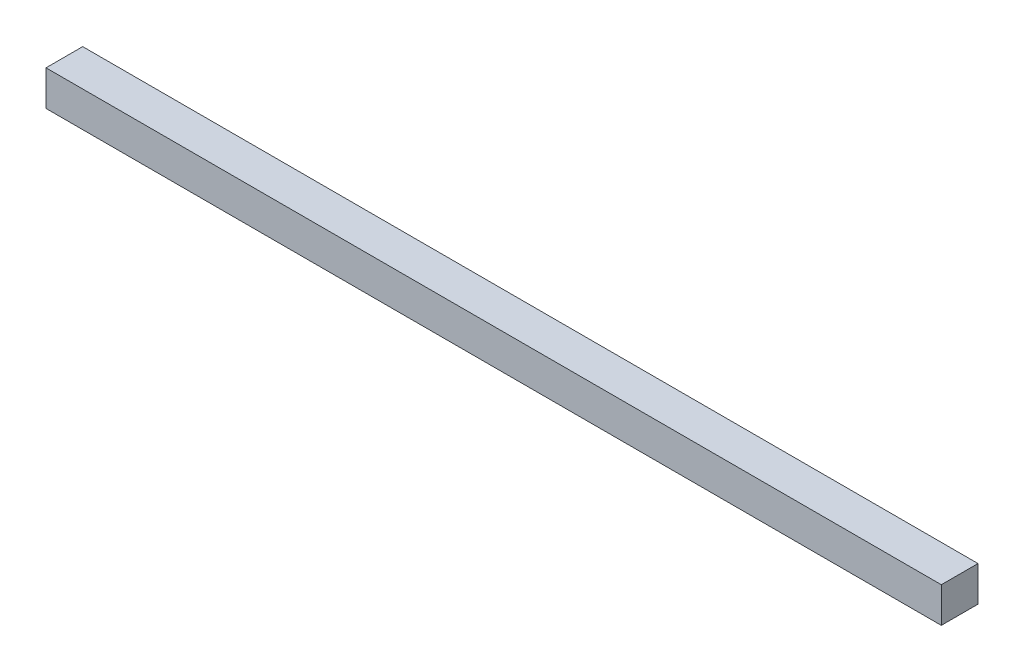
from build123d import *

# Parameters (mm, degrees)
SKETCH1_W            = 330
SKETCH1_H            = 275
SKETCH1_W_2          = 305
SKETCH1_H_2          = 250
BOSS_EXTRUDE4_DEPTH  = 12
BOSS_EXTRUDE6_DEPTH  = 12.5
BOSS_EXTRUDE7_DEPTH  = 12.5
SKETCH6_R            = 15
SKETCH6_R_2          = 11
BOSS_EXTRUDE8_DEPTH  = 12.5
SKETCH7_R            = 11
CUT_EXTRUDE2_DEPTH   = 383.003996993
BOSS_EXTRUDE9_REACH  = 283.371
SKETCH8_W            = 12.5
SKETCH8_H            = 10
BOSS_EXTRUDE10_REACH = 283.371
SKETCH9_W            = 12.5
SKETCH9_H            = 10
SKETCH10_W           = 25
SKETCH10_H           = 25
BOSS_EXTRUDE11_DEPTH = 12.5
SKETCH12_W           = 363.183166413
SKETCH12_H           = 208.972436991
CUT_EXTRUDE4_DEPTH   = 12.5
SKETCH13_W           = 88.849719952
SKETCH13_H           = 202.412650545
CUT_EXTRUDE5_DEPTH   = 12.5
SKETCH14_W           = 344.745227795
SKETCH14_H           = 211.856588458
CUT_EXTRUDE6_DEPTH   = 12.5
SKETCH15_W           = 201.860066461
SKETCH15_H           = 74.495762376
CUT_EXTRUDE7_DEPTH   = 390.5


with BuildPart() as part:
    # Sketch1 → Boss-Extrude4 (new body)
    with BuildSketch(Plane(origin=(0, 0, 0), x_dir=(1, 0, 0), z_dir=(0, 1, 0))):
        Rectangle(SKETCH1_W, SKETCH1_H)
        Rectangle(SKETCH1_W_2, SKETCH1_H_2, mode=Mode.SUBTRACT)
    extrude(amount=BOSS_EXTRUDE4_DEPTH)

    # Sketch2 → Boss-Extrude6 (add)
    with BuildSketch(Plane(origin=(165, 0, 0), x_dir=(0, 0, -1), z_dir=(1, 0, 0))):
        Polygon((0, 152), (-137.5, 12), (-127.5, 12), (0, 141.818181818), (127.5, 12), (137.5, 12), align=None)
    extrude(amount=-BOSS_EXTRUDE6_DEPTH)

    # Sketch5 → Boss-Extrude7 (add)
    with BuildSketch(Plane.ZY.offset(165)):
        Polygon((0, 152), (-137.5, 12), (-127.5, 12), (0, 141.818181818), (127.5, 12), (137.5, 12), align=None)
    extrude(amount=-BOSS_EXTRUDE7_DEPTH)

    # Sketch6 → Boss-Extrude8 (add)
    with BuildSketch(Plane.ZY.offset(-152.5)):
        with Locations((0, 146.909090909)):
            Circle(SKETCH6_R)
        with Locations((0, 146.909090909)):
            Circle(SKETCH6_R_2, mode=Mode.SUBTRACT)
    extrude(amount=-BOSS_EXTRUDE8_DEPTH)

    # Sketch7 → Cut-Extrude2 (cut, through all)
    with BuildSketch(Plane.ZY.offset(-152.5)):
        with Locations((0, 146.909090909)):
            Circle(SKETCH7_R)
    extrude(amount=-CUT_EXTRUDE2_DEPTH, mode=Mode.SUBTRACT)

    # Boss-Extrude9: up to this plane
    boss_extrude9_end = Plane(origin=(0, 12, 0), z_dir=(0, -1, 0))
    # Sketch8 → Boss-Extrude9 (add, up to the surface)
    with BuildSketch(Plane(origin=(0, 69.631553319, 70.897581561), x_dir=(-1, 0, 0), z_dir=(0, -0.7007080148842544, -0.7134481606094221)), mode=Mode.PRIVATE) as boss_extrude9_sk1:
        with Locations((-158.75, 10.200513494)):
            Rectangle(SKETCH8_W, SKETCH8_H)
    boss_extrude9_tool1 = split(extrude(boss_extrude9_sk1.sketch, amount=BOSS_EXTRUDE9_REACH, mode=Mode.PRIVATE), bisect_by=boss_extrude9_end, keep=Keep.BOTH, mode=Mode.PRIVATE)
    add(boss_extrude9_tool1.solids().sort_by_distance((158.75, 76.909091, 63.75))[0])
    # Sketch8 → Boss-Extrude9 (add, up to the surface)
    with BuildSketch(Plane(origin=(0, 69.631553319, 70.897581561), x_dir=(-1, 0, 0), z_dir=(0, -0.7007080148842544, -0.7134481606094221)), mode=Mode.PRIVATE) as boss_extrude9_sk2:
        with Locations((158.75, 10.200513494)):
            Rectangle(SKETCH8_W, SKETCH8_H)
    boss_extrude9_tool2 = split(extrude(boss_extrude9_sk2.sketch, amount=BOSS_EXTRUDE9_REACH, mode=Mode.PRIVATE), bisect_by=boss_extrude9_end, keep=Keep.BOTH, mode=Mode.PRIVATE)
    add(boss_extrude9_tool2.solids().sort_by_distance((-158.75, 76.909091, 63.75))[0])

    # Boss-Extrude10: up to this plane
    boss_extrude10_end = Plane(origin=(0, 12, 0), z_dir=(0, -1, 0))
    # Sketch9 → Boss-Extrude10 (add, up to the surface)
    with BuildSketch(Plane(origin=(0, 69.631553319, -70.897581561), x_dir=(1, 0, 0), z_dir=(0, -0.7007080148842544, 0.7134481606094221)), mode=Mode.PRIVATE) as boss_extrude10_sk1:
        with Locations((-158.75, 10.200513494)):
            Rectangle(SKETCH9_W, SKETCH9_H)
    boss_extrude10_tool1 = split(extrude(boss_extrude10_sk1.sketch, amount=BOSS_EXTRUDE10_REACH, mode=Mode.PRIVATE), bisect_by=boss_extrude10_end, keep=Keep.BOTH, mode=Mode.PRIVATE)
    add(boss_extrude10_tool1.solids().sort_by_distance((-158.75, 76.909091, -63.75))[0])
    # Sketch9 → Boss-Extrude10 (add, up to the surface)
    with BuildSketch(Plane(origin=(0, 69.631553319, -70.897581561), x_dir=(1, 0, 0), z_dir=(0, -0.7007080148842544, 0.7134481606094221)), mode=Mode.PRIVATE) as boss_extrude10_sk2:
        with Locations((158.75, 10.200513494)):
            Rectangle(SKETCH9_W, SKETCH9_H)
    boss_extrude10_tool2 = split(extrude(boss_extrude10_sk2.sketch, amount=BOSS_EXTRUDE10_REACH, mode=Mode.PRIVATE), bisect_by=boss_extrude10_end, keep=Keep.BOTH, mode=Mode.PRIVATE)
    add(boss_extrude10_tool2.solids().sort_by_distance((158.75, 76.909091, -63.75))[0])

    # Sketch10 → Boss-Extrude11 (add)
    with BuildSketch(Plane(origin=(-152.5, 0, 0), x_dir=(0, 0, -1), z_dir=(1, 0, 0))):
        with Locations((0, 146.909090909)):
            Rectangle(SKETCH10_W, SKETCH10_H)
    extrude(amount=-BOSS_EXTRUDE11_DEPTH)

    # Sketch11 → Revolve1 (revolve)
    with BuildSketch(Plane.XY, mode=Mode.PRIVATE) as revolve1_sk:
        with BuildLine():
            Line((152.5, 157.909090909), (152.5, 161.909090909))
            ThreePointArc((152.5, 161.909090909), (149.508436085, 160.260408588), (146.516872171, 161.909090909))
            Line((146.516872171, 161.909090909), (146.516872171, 157.909090909))
            Line((146.516872171, 157.909090909), (152.5, 157.909090909))
        make_face()
    revolve(revolve1_sk.sketch.rotate(Axis((152.5, 146.909090909, 0), (-1, 0, 0)), 270), axis=Axis((152.5, 146.909090909, 0), (-1, 0, 0)))

    # Sketch12 → Cut-Extrude4 (cut)
    with BuildSketch(Plane(origin=(165, 0, 0), x_dir=(0, 0, -1), z_dir=(1, 0, 0))):
        with Locations((44.091583207, 104.486218496)):
            Rectangle(SKETCH12_W, SKETCH12_H)
    extrude(amount=-CUT_EXTRUDE4_DEPTH, mode=Mode.SUBTRACT)


with BuildPart() as cut_extrude4_piece_1:
    # of the separate pieces the step leaves, piece 1, a body of its own (cut_extrude4_pieces)
    add(part.part.solids().sort_by_distance((-165, 0, 137.5))[0])

    # Sketch14 → Cut-Extrude6 (cut)
    with BuildSketch(Plane.ZY.offset(165)):
        with Locations((34.872613898, 105.928294229)):
            Rectangle(SKETCH14_W, SKETCH14_H)
    extrude(amount=-CUT_EXTRUDE6_DEPTH, mode=Mode.SUBTRACT)


with BuildPart() as cut_extrude4_piece_2:
    # of the separate pieces the step leaves, piece 2, a body of its own (cut_extrude4_pieces)
    add(part.part.solids().sort_by_distance((152.5, 146.909090909, 15))[0])

    # Sketch13 → Cut-Extrude5 (cut)
    with BuildSketch(Plane(origin=(152.5, 0, 0), x_dir=(0, 0, -1), z_dir=(1, 0, 0))):
        with Locations((6.94645411, 119.375900047)):
            Rectangle(SKETCH13_W, SKETCH13_H)
    extrude(amount=-CUT_EXTRUDE5_DEPTH, mode=Mode.SUBTRACT)


with BuildPart() as cut_extrude6_piece_1:
    # of the separate pieces the step leaves, piece 1, a body of its own (cut_extrude6_pieces)
    add(cut_extrude4_piece_1.part.solids().sort_by_distance((-152.5, 0, 137.5))[0])


with BuildPart() as cut_extrude6_piece_2:
    # of the separate pieces the step leaves, piece 2, a body of its own (cut_extrude6_pieces)
    add(cut_extrude4_piece_1.part.solids().sort_by_distance((152.5, 0, -137.5))[0])

    # Sketch15 → Cut-Extrude7 (cut)
    with BuildSketch(Plane.ZY.offset(152.5)):
        with Locations((-150.903608873, -3.880446808)):
            Rectangle(SKETCH15_W, SKETCH15_H)
    extrude(amount=-CUT_EXTRUDE7_DEPTH, mode=Mode.SUBTRACT)


solid = cut_extrude6_piece_1.part
